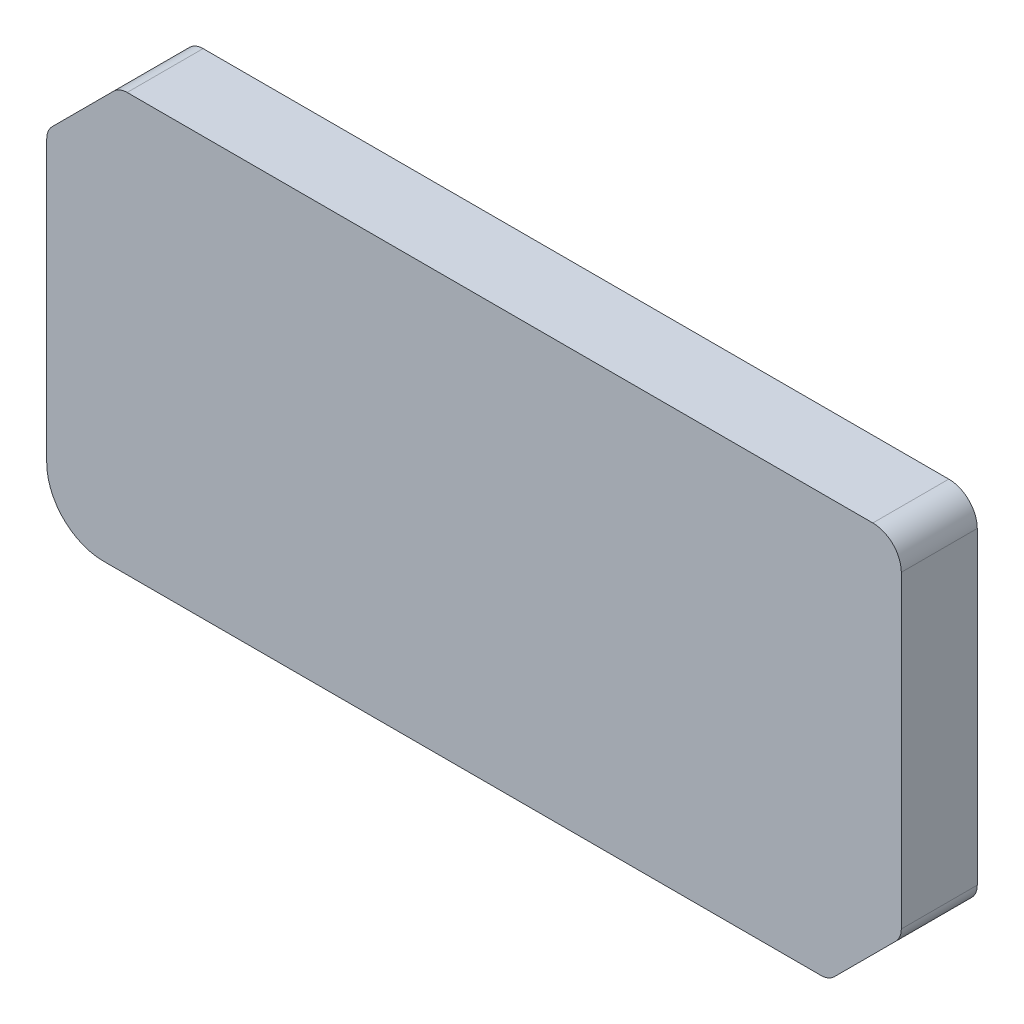
from build123d import *

# Parameters (mm, degrees)
SKETCH1_W           = 225
SKETCH1_H           = 110
BOSS_EXTRUDE2_DEPTH = 10
CHAMFER1_SIZE       = 19.1
FILLET1_R           = 15
FILLET2_R           = 7.5
FILLET3_R           = 5
SKETCH4_R           = 18.521812
SKETCH4_W           = 42.513724
SKETCH4_H           = 32
SKETCH4_R_2         = 35.732188
SKETCH4_R_3         = 27.537925
BOSS_EXTRUDE4_DEPTH = 20
FILLET4_R           = 2
FILLET5_R           = 1
FILLET6_R           = 1
FILLET7_R           = 1
FILLET8_R           = 1
FILLET9_R           = 1
FILLET10_R          = 1


with BuildPart() as part:
    # Sketch1 → Boss-Extrude2 (new body)
    with BuildSketch(Plane.XY):
        Rectangle(SKETCH1_W, SKETCH1_H)
    extrude(amount=BOSS_EXTRUDE2_DEPTH)

    # Chamfer1
    chamfer1_edges = [part.edges().sort_by_distance(p)[0] for p in [
        (112.5, -55, 5),
        (-112.5, 55, 5),
    ]]
    chamfer(chamfer1_edges, length=CHAMFER1_SIZE)

    # Fillet1
    fillet1_edges = [part.edges().sort_by_distance(p)[0] for p in [
        (-112.5, -55, 5),
    ]]
    fillet(fillet1_edges, radius=FILLET1_R)

    # Fillet2
    fillet2_edges = [part.edges().sort_by_distance(p)[0] for p in [
        (112.5, 55, 5),
    ]]
    fillet(fillet2_edges, radius=FILLET2_R)

    # Fillet3
    fillet3_edges = [part.edges().sort_by_distance(p)[0] for p in [
        (112.5, -35.9, 5),
        (93.4, -55, 5),
        (-112.5, 35.9, 5),
        (-93.4, 55, 5),
    ]]
    fillet(fillet3_edges, radius=FILLET3_R)

    # Sketch4 → Boss-Extrude4 (add)
    # profile 1 of 2: a face of its own
    with BuildSketch(Plane.XY.offset(10)):
        with BuildLine():
            ThreePointArc((112.5, 47.5), (110.303301, 52.803301), (105, 55))
            Line((105, 55), (-91.328932, 55))
            ThreePointArc((-91.328932, 55), (-93.242349, 54.619398), (-94.864466, 53.535534))
            Line((-94.864466, 53.535534), (-111.035534, 37.364466))
            ThreePointArc((-111.035534, 37.364466), (-112.119398, 35.742349), (-112.5, 33.828932))
            Line((-112.5, 33.828932), (-112.5, -40))
            ThreePointArc((-112.5, -40), (-108.106602, -50.606602), (-97.5, -55))
            Line((-97.5, -55), (91.328932, -55))
            ThreePointArc((91.328932, -55), (93.242349, -54.619398), (94.864466, -53.535534))
            Line((94.864466, -53.535534), (111.035534, -37.364466))
            ThreePointArc((111.035534, -37.364466), (112.119398, -35.742349), (112.5, -33.828932))
            Line((112.5, -33.828932), (112.5, 47.5))
        make_face()
        with BuildLine():
            Line((-66.986276, -52), (-97.5, -52))
            ThreePointArc((-97.5, -52), (-105.985281, -48.485281), (-109.5, -40))
            Line((-109.5, -40), (-109.5, -21))
            Line((-109.5, -21), (-66.986276, -21))
            Line((-66.986276, -21), (-66.986276, -52))
        make_face(mode=Mode.SUBTRACT)
        with Locations((57.333382, -22.805237)):
            Circle(SKETCH4_R, mode=Mode.SUBTRACT)
        with BuildLine():
            Line((-66.986276, 52), (-66.986276, 17))
            Line((-66.986276, 17), (-109.5, 17))
            Line((-109.5, 17), (-109.5, 33.828932))
            ThreePointArc((-109.5, 33.828932), (-109.347759, 34.594299), (-108.914214, 35.243146))
            Line((-108.914214, 35.243146), (-92.743146, 51.414214))
            ThreePointArc((-92.743146, 51.414214), (-92.094299, 51.847759), (-91.328932, 52))
            Line((-91.328932, 52), (-66.986276, 52))
        make_face(mode=Mode.SUBTRACT)
        with Locations((-88.243138, -2)):
            Rectangle(SKETCH4_W, SKETCH4_H, mode=Mode.SUBTRACT)
        with Locations((-17.262987, 0)):
            Circle(SKETCH4_R_2, mode=Mode.SUBTRACT)
        with Locations((57.333382, 22.805237)):
            Circle(SKETCH4_R, mode=Mode.SUBTRACT)
    # profile 2 of 2: a face of its own
    with BuildSketch(Plane.XY.offset(10)):
        with Locations((-17.262987, 0)):
            Circle(SKETCH4_R_3)
    extrude(amount=-BOSS_EXTRUDE4_DEPTH)

    # Fillet4
    fillet4_edges = [part.edges().sort_by_distance(p)[0] for p in [
        (38.811571, -22.805237, -10),
        (-52.995175, 0, -10),
        (38.811571, 22.805237, -10),
    ]]
    fillet(fillet4_edges, radius=FILLET4_R)

    # Fillet5
    fillet5_edges = [part.edges().sort_by_distance(p)[0] for p in [
        (-44.800912, 0, -10),
    ]]
    fillet(fillet5_edges, radius=FILLET5_R)

    # Fillet6
    fillet6_edges = [part.edges().sort_by_distance(p)[0] for p in [
        (-66.986276, -21, -5),
        (-109.5, -21, -5),
        (-66.986276, -52, -5),
    ]]
    fillet(fillet6_edges, radius=FILLET6_R)

    # Fillet7
    fillet7_edges = [part.edges().sort_by_distance(p)[0] for p in [
        (-66.986276, 52, -5),
        (-109.5, 17, -5),
        (-66.986276, 14, -5),
        (-109.5, 14, -5),
        (-109.5, -18, -5),
        (-66.986276, 17, -5),
        (-66.986276, -18, -5),
    ]]
    fillet(fillet7_edges, radius=FILLET7_R)

    # Fillet8
    fillet8_edges = [part.edges().sort_by_distance(p)[0] for p in [
        (-92.094299, 51.847759, -10),
        (-100.82868, 43.32868, -10),
        (-109.347759, 34.594299, -10),
        (-109.5, 25.914466, -10),
        (-88.243138, 17, -10),
        (-79.657604, 52, -10),
        (-66.986276, 34.5, -10),
        (-109.207107, 17.292893, -10),
        (-67.279169, 51.707107, -10),
        (-67.279169, 17.292893, -10),
    ]]
    fillet(fillet8_edges, radius=FILLET8_R)

    # Fillet9
    fillet9_edges = [part.edges().sort_by_distance(p)[0] for p in [
        (-109.5, -2, -10),
        (-88.243138, 14, -10),
        (-66.986276, -2, -10),
        (-88.243138, -18, -10),
        (-109.207107, 13.707107, -10),
        (-67.279169, 13.707107, -10),
        (-67.279169, -17.707107, -10),
        (-109.207107, -17.707107, -10),
    ]]
    fillet(fillet9_edges, radius=FILLET9_R)

    # Fillet10
    fillet10_edges = [part.edges().sort_by_distance(p)[0] for p in [
        (-105.985281, -48.485281, -10),
        (-82.743138, -52, -10),
        (-66.986276, -36.5, -10),
        (-88.243138, -21, -10),
        (-109.5, -31, -10),
        (-67.279169, -51.707107, -10),
        (-67.279169, -21.292893, -10),
        (-109.207107, -21.292893, -10),
    ]]
    fillet(fillet10_edges, radius=FILLET10_R)


solid = part.part
